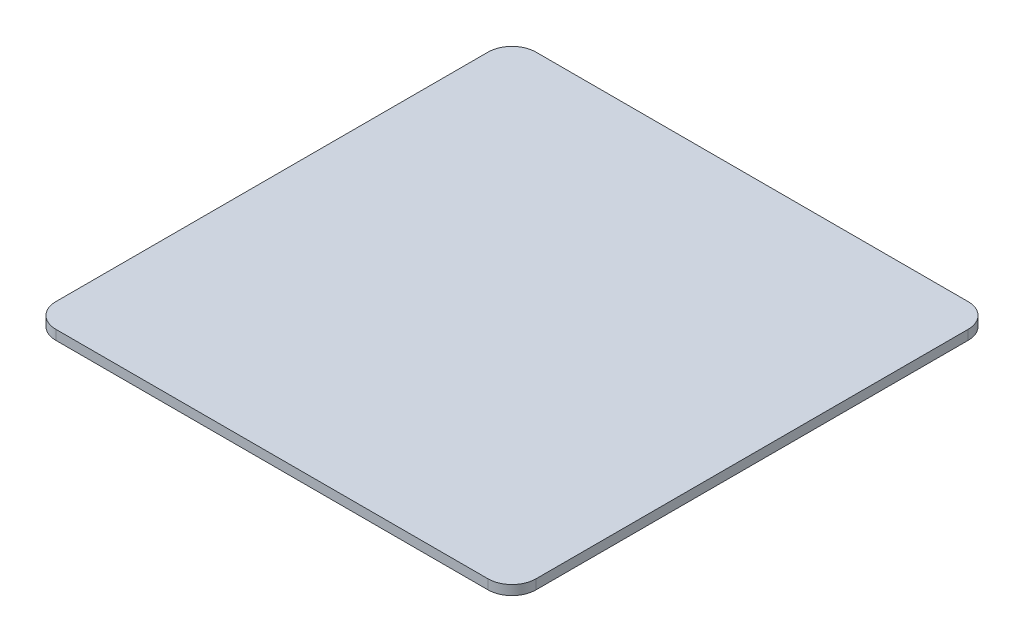
from build123d import *

# Parameters (mm, degrees)
SKETCH1_W           = 50
SKETCH1_H           = 50
BOSS_EXTRUDE1_DEPTH = 1
FILLET1_R           = 2.5


with BuildPart() as part:
    # Sketch1 → Boss-Extrude1 (new body)
    with BuildSketch(Plane(origin=(0, 0, 0), x_dir=(1, 0, 0), z_dir=(0, 1, 0))):
        Rectangle(SKETCH1_W, SKETCH1_H)
    extrude(amount=BOSS_EXTRUDE1_DEPTH)

    # Fillet1
    fillet1_edges = [part.edges().sort_by_distance(p)[0] for p in [
        (25, 0.5, 25),
        (-25, 0.5, 25),
        (-25, 0.5, -25),
        (25, 0.5, -25),
    ]]
    fillet(fillet1_edges, radius=FILLET1_R)


solid = part.part
